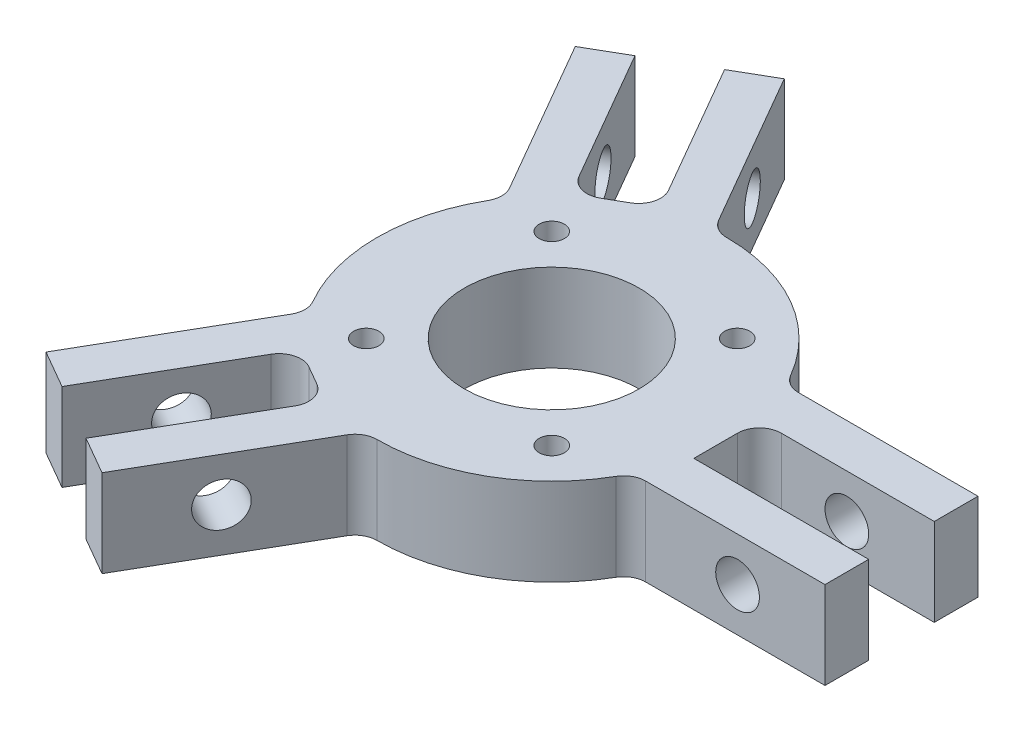
from build123d import *

# Parameters (mm, degrees)
SKETCH1_R                             = 12.7
SKETCH1_R_2                           = 1.8288
BOSS_EXTRUDE1_DEPTH                   = 6.35
F_1_4_0_25_DIAMETER_HOLE1_D           = 6.35
F_1_4_0_25_DIAMETER_HOLE1_ON_FACE_2_D = 6.35
F_1_4_0_25_DIAMETER_HOLE1_ON_FACE_3_D = 6.35
F_1_4_0_25_DIAMETER_HOLE1_ON_FACE_4_D = 6.35
F_1_4_0_25_DIAMETER_HOLE1_ON_FACE_5_D = 6.35
F_1_4_0_25_DIAMETER_HOLE1_ON_FACE_6_D = 6.35
FILLET1_R                             = 3.175


with BuildPart() as part:
    # Sketch1 → Boss-Extrude1 (new, symmetric)
    with BuildSketch(Plane(origin=(0, 0, 0), x_dir=(1, 0, 0), z_dir=(0, 1, 0))):
        with BuildLine():
            Line((25.4, 4.7625), (25.4, -4.7625))
            Line((25.4, -4.7625), (50.8, -4.7625))
            Line((50.8, -4.7625), (50.8, -11.1125))
            Line((50.8, -11.1125), (22.84014763, -11.1125))
            ThreePointArc((22.84014763, -11.1125), (12.7, -21.997045256), (-1.796366515, -25.336398074))
            Line((-1.796366515, -25.336398074), (-15.7762927, -49.550340512))
            Line((-15.7762927, -49.550340512), (-21.275554014, -46.375340512))
            Line((-21.275554014, -46.375340512), (-8.575554014, -24.378295256))
            Line((-8.575554014, -24.378295256), (-16.824445986, -19.615795256))
            Line((-16.824445986, -19.615795256), (-29.524445986, -41.612840512))
            Line((-29.524445986, -41.612840512), (-35.0237073, -38.437840512))
            Line((-35.0237073, -38.437840512), (-21.043781114, -14.223898074))
            ThreePointArc((-21.043781114, -14.223898074), (-25.4, 0), (-21.043781114, 14.223898074))
            Line((-21.043781114, 14.223898074), (-35.0237073, 38.437840512))
            Line((-35.0237073, 38.437840512), (-29.524445986, 41.612840512))
            Line((-29.524445986, 41.612840512), (-16.824445986, 19.615795256))
            Line((-16.824445986, 19.615795256), (-8.575554014, 24.378295256))
            Line((-8.575554014, 24.378295256), (-21.275554014, 46.375340512))
            Line((-21.275554014, 46.375340512), (-15.7762927, 49.550340512))
            Line((-15.7762927, 49.550340512), (-1.796366515, 25.336398074))
            ThreePointArc((-1.796366515, 25.336398074), (12.7, 21.997045256), (22.84014763, 11.1125))
            Line((22.84014763, 11.1125), (50.8, 11.1125))
            Line((50.8, 11.1125), (50.8, 4.7625))
            Line((50.8, 4.7625), (25.4, 4.7625))
        make_face()
        with Locations(Location((0, 0, 0), (0, 0, 270))):
            Circle(SKETCH1_R, mode=Mode.SUBTRACT)
        with Locations(Location((-13.470384182, 13.470384182, 0), (0, 0, 270))):
            Circle(SKETCH1_R_2, mode=Mode.SUBTRACT)
        with Locations(Location((13.470384182, 13.470384182, 0), (0, 0, 270))):
            Circle(SKETCH1_R_2, mode=Mode.SUBTRACT)
        with Locations(Location((13.470384182, -13.470384182, 0), (0, 0, 270))):
            Circle(SKETCH1_R_2, mode=Mode.SUBTRACT)
        with Locations(Location((-13.470384182, -13.470384182, 0), (0, 0, 270))):
            Circle(SKETCH1_R_2, mode=Mode.SUBTRACT)
    extrude(amount=BOSS_EXTRUDE1_DEPTH, both=True)

    # 1/4 (0.25) Diameter Hole1 (through all)
    with Locations(Plane(origin=(38.1, 0, -4.7625), x_dir=(0, 1, 0), z_dir=(0, 0, 1))):
        with Locations((0, 0)):
            Hole(F_1_4_0_25_DIAMETER_HOLE1_D / 2)

    # 1/4 (0.25) Diameter Hole1 on face 2 (through all)
    with Locations(Plane(origin=(-14.925554014, 0, -35.376817884), x_dir=(-0.500000174844, 0, -0.866025302838), z_dir=(-0.866025302838, 0, 0.500000174844))):
        with Locations((0, 0)):
            Hole(F_1_4_0_25_DIAMETER_HOLE1_ON_FACE_2_D / 2)

    # 1/4 (0.25) Diameter Hole1 on face 3 (through all)
    with Locations(Plane(origin=(-23.174445986, 0, 30.614317884), x_dir=(-0.500000174844, 0, 0.866025302838), z_dir=(0.866025302838, 0, 0.500000174844))):
        with Locations((0, 0)):
            Hole(F_1_4_0_25_DIAMETER_HOLE1_ON_FACE_3_D / 2)

    # 1/4 (0.25) Diameter Hole1 on face 4 (through all)
    with Locations(Plane(origin=(-14.925554014, 0, 35.376817884), x_dir=(0.500000174844, 0, -0.866025302838), z_dir=(-0.866025302838, 0, -0.500000174844))):
        with Locations((0, 0)):
            Hole(F_1_4_0_25_DIAMETER_HOLE1_ON_FACE_4_D / 2)

    # 1/4 (0.25) Diameter Hole1 on face 5 (through all)
    with Locations(Plane(origin=(-23.174445986, 0, -30.614317884), x_dir=(0.500000174844, 0, 0.866025302838), z_dir=(0.866025302838, 0, -0.500000174844))):
        with Locations((0, 0)):
            Hole(F_1_4_0_25_DIAMETER_HOLE1_ON_FACE_5_D / 2)

    # 1/4 (0.25) Diameter Hole1 on face 6 (through all)
    with Locations(Plane(origin=(38.1, 0, 4.7625), x_dir=(-1, 0, 0), z_dir=(0, 0, -1))):
        with Locations((0, 0)):
            Hole(F_1_4_0_25_DIAMETER_HOLE1_ON_FACE_6_D / 2)

    # Fillet1
    fillet1_edges = [part.edges().sort_by_distance(p)[0] for p in [
        (25.4, 0, -4.7625),
        (22.84014763, 0, 11.1125),
        (-1.796366515, 0, 25.336398074),
        (-8.575554014, 0, 24.378295256),
        (-16.824445986, 0, 19.615795256),
        (-21.043781114, 0, 14.223898074),
        (-21.043781114, 0, -14.223898074),
        (-16.824445986, 0, -19.615795256),
        (-8.575554014, 0, -24.378295256),
        (-1.796366515, 0, -25.336398074),
        (22.84014763, 0, -11.1125),
    ]]
    fillet(fillet1_edges, radius=FILLET1_R)


solid = part.part
